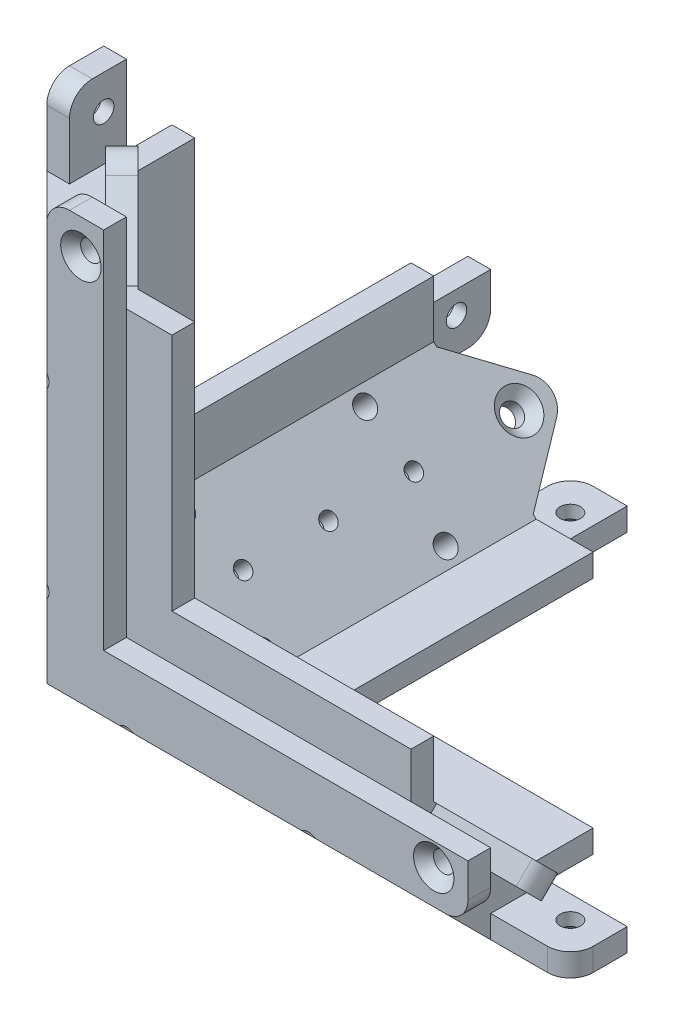
from build123d import *

# Parameters (mm, degrees)
BOSS_EXTRUDE1_DEPTH = 78
BOSS_EXTRUDE2_DEPTH = 70
BOSS_EXTRUDE3_DEPTH = 70
CHAMFER1_SIZE       = 18
CHAMFER2_SIZE       = 18
SKETCH4_W           = 100.995280533
SKETCH4_H           = 50
CUT_EXTRUDE1_DEPTH  = 4
SKETCH5_W           = 50
SKETCH5_H           = 50
CUT_EXTRUDE2_DEPTH  = 4
SKETCH6_W           = 50
SKETCH6_H           = 50
CUT_EXTRUDE3_DEPTH  = 4
SKETCH7_R           = 1.4
CUT_EXTRUDE7_DEPTH  = 3.5
SKETCH8_R           = 1.4
CUT_EXTRUDE8_DEPTH  = 3.5
SKETCH10_R          = 1.4
CUT_EXTRUDE9_DEPTH  = 3.5
SKETCH11_W          = 10
SKETCH11_H          = 4
SKETCH11_W_2        = 4
SKETCH11_H_2        = 10
BOSS_EXTRUDE4_DEPTH = 14
FILLET1_R           = 4
BOSS_EXTRUDE5_DEPTH = 4
FILLET2_R           = 4
SKETCH13_W          = 10
SKETCH13_H          = 4
SKETCH13_W_2        = 4
SKETCH13_H_2        = 10
BOSS_EXTRUDE6_DEPTH = 14
FILLET3_R           = 4
BOSS_EXTRUDE7_DEPTH = 4
FILLET4_R           = 4
BOSS_EXTRUDE8_DEPTH = 4
FILLET5_R           = 4
SKETCH16_W          = 4
SKETCH16_H          = 10
SKETCH16_W_2        = 10
SKETCH16_H_2        = 4
BOSS_EXTRUDE9_DEPTH = 14
FILLET6_R           = 4
SKETCH17_R          = 1.8
CUT_EXTRUDE10_DEPTH = 14
SKETCH18_R          = 1.8
CUT_EXTRUDE11_DEPTH = 14
SKETCH19_R          = 1.8
CUT_EXTRUDE12_DEPTH = 14
SKETCH20_R          = 1.8
CUT_EXTRUDE13_DEPTH = 14
SKETCH21_R          = 1.8
CUT_EXTRUDE14_DEPTH = 14
SKETCH22_R          = 1.8
CUT_EXTRUDE15_DEPTH = 14
CHAMFER3_SIZE       = 1.75
SKETCH27_R          = 1.8
CUT_EXTRUDE19_DEPTH = 141.406552554
SKETCH29_R          = 3
CUT_EXTRUDE20_DEPTH = 4
SKETCH31_R          = 1.8
CUT_EXTRUDE21_DEPTH = 150.13752043
SKETCH32_R          = 3
CUT_EXTRUDE22_DEPTH = 4
SKETCH33_R          = 1.8
CUT_EXTRUDE23_DEPTH = 150.13752043
SKETCH34_R          = 3
CUT_EXTRUDE24_DEPTH = 4


with BuildPart() as part:
    # Sketch1 → Boss-Extrude1 (new body)
    with BuildSketch(Plane(origin=(0, 0, 0), x_dir=(0, 0, -1), z_dir=(1, 0, 0))):
        Polygon((0, 36), (0, 0), (36, 0), (36, 8), (8, 8), (8, 36), align=None)
    extrude(amount=BOSS_EXTRUDE1_DEPTH)

    # Sketch2 → Boss-Extrude2 (add)
    with BuildSketch(Plane(origin=(0, 0, -8), x_dir=(-1, 0, 0), z_dir=(0, 0, -1))):
        Polygon((0, 36), (-8, 36), (-8, 8), (-36, 8), (-36, 0), (0, 0), align=None)
    extrude(amount=BOSS_EXTRUDE2_DEPTH)

    # Sketch3 → Boss-Extrude3 (add)
    with BuildSketch(Plane(origin=(0, 8, 0), x_dir=(1, 0, 0), z_dir=(0, 1, 0))):
        Polygon((0, 0), (0, 36), (8, 36), (8, 8), (36, 8), (36, 0), align=None)
    extrude(amount=BOSS_EXTRUDE3_DEPTH)

    # Chamfer1
    chamfer1_edges = [part.edges().sort_by_distance(p)[0] for p in [
        (43, 8, -8),
        (8, 8, -43),
        (8, 43, -8),
    ]]
    chamfer(chamfer1_edges, length=CHAMFER1_SIZE)

    # Chamfer2
    chamfer2_edges = [part.edges().sort_by_distance(p)[0] for p in [
        (39, 0, 0),
        (0, 0, -39),
        (0, 39, 0),
    ]]
    chamfer(chamfer2_edges, length=CHAMFER2_SIZE)

    # Sketch4 → Cut-Extrude1 (cut)
    with BuildSketch(Plane(origin=(0, 0, 0), x_dir=(-1, 0, 0), z_dir=(0, -1, 0))):
        with Locations((-78.497640266, 53)):
            Rectangle(SKETCH4_W, SKETCH4_H)
    extrude(amount=-CUT_EXTRUDE1_DEPTH, mode=Mode.SUBTRACT)

    # Sketch5 → Cut-Extrude2 (cut)
    with BuildSketch(Plane.XY):
        with Locations((53, 53)):
            Rectangle(SKETCH5_W, SKETCH5_H)
    extrude(amount=-CUT_EXTRUDE2_DEPTH, mode=Mode.SUBTRACT)

    # Sketch6 → Cut-Extrude3 (cut)
    with BuildSketch(Plane.ZY):
        with Locations((-53, 53)):
            Rectangle(SKETCH6_W, SKETCH6_H)
    extrude(amount=-CUT_EXTRUDE3_DEPTH, mode=Mode.SUBTRACT)

    # Sketch7 → Cut-Extrude7 (cut)
    with BuildSketch(Plane(origin=(17, 17, 0), x_dir=(0, 0, -1), z_dir=(0.7071067811865513, 0.7071067811865438, 0))):
        with Locations(Location((65.5, 0, 0), (0, 0, 90))):
            Circle(SKETCH7_R)
        with Locations(Location((50.5, 0, 0), (0, 0, 90))):
            Circle(SKETCH7_R)
        with Locations(Location((35.5, 0, 0), (0, 0, 90))):
            Circle(SKETCH7_R)
    extrude(amount=-CUT_EXTRUDE7_DEPTH, mode=Mode.SUBTRACT)

    # Sketch8 → Cut-Extrude8 (cut)
    with BuildSketch(Plane(origin=(17, 0, -17), x_dir=(-0.7071067811865438, 0, -0.7071067811865513), z_dir=(0.7071067811865513, 0, -0.7071067811865438))):
        with Locations((0, 65.5)):
            Circle(SKETCH8_R)
        with Locations((0, 50.5)):
            Circle(SKETCH8_R)
        with Locations((0, 35.5)):
            Circle(SKETCH8_R)
    extrude(amount=-CUT_EXTRUDE8_DEPTH, mode=Mode.SUBTRACT)

    # Sketch10 → Cut-Extrude9 (cut)
    with BuildSketch(Plane(origin=(0, 17, -17), x_dir=(1, 0, 0), z_dir=(0, 0.7071067811865513, -0.7071067811865438))):
        with Locations(Location((65.5, 0, 0), (0, 0, 270))):
            Circle(SKETCH10_R)
        with Locations(Location((50.5, 0, 0), (0, 0, 270))):
            Circle(SKETCH10_R)
        with Locations(Location((35.5, 0, 0), (0, 0, 270))):
            Circle(SKETCH10_R)
    extrude(amount=-CUT_EXTRUDE9_DEPTH, mode=Mode.SUBTRACT)

    # Sketch11 → Boss-Extrude4 (add)
    with BuildSketch(Plane(origin=(78, 0, 0), x_dir=(0, 0, -1), z_dir=(1, 0, 0))):
        with Locations((23, 2)):
            Rectangle(SKETCH11_W, SKETCH11_H)
        with Locations((2, 23)):
            Rectangle(SKETCH11_W_2, SKETCH11_H_2)
    extrude(amount=BOSS_EXTRUDE4_DEPTH)

    # Fillet1
    fillet1_edges = [part.edges().sort_by_distance(p)[0] for p in [
        (92, 18, -2),
        (92, 2, -18),
    ]]
    fillet(fillet1_edges, radius=FILLET1_R)

    # Sketch12 → Boss-Extrude5 (add)
    with BuildSketch(Plane(origin=(0, 17, -17), x_dir=(1, 0, 0), z_dir=(0, 0.7071067811865513, -0.7071067811865438))):
        Polygon((78, 12), (92, 0), (78, -12), align=None)
    extrude(amount=-BOSS_EXTRUDE5_DEPTH)

    # Fillet2
    fillet2_edges = [part.edges().sort_by_distance(p)[0] for p in [
        (92, 15.585786438, -15.585786438),
    ]]
    fillet(fillet2_edges, radius=FILLET2_R)

    # Sketch13 → Boss-Extrude6 (add)
    with BuildSketch(Plane(origin=(0, 0, -78), x_dir=(-1, 0, 0), z_dir=(0, 0, -1))):
        with Locations((-23, 2)):
            Rectangle(SKETCH13_W, SKETCH13_H)
        with Locations((-2, 23)):
            Rectangle(SKETCH13_W_2, SKETCH13_H_2)
    extrude(amount=BOSS_EXTRUDE6_DEPTH)

    # Fillet3
    fillet3_edges = [part.edges().sort_by_distance(p)[0] for p in [
        (18, 2, -92),
        (2, 18, -92),
    ]]
    fillet(fillet3_edges, radius=FILLET3_R)

    # Sketch14 → Boss-Extrude7 (add)
    with BuildSketch(Plane(origin=(17, 17, 0), x_dir=(0, 0, -1), z_dir=(0.7071067811865511, 0.707106781186544, 0))):
        Polygon((78, 12), (92, 0), (78, -12), align=None)
    extrude(amount=-BOSS_EXTRUDE7_DEPTH)

    # Fillet4
    fillet4_edges = [part.edges().sort_by_distance(p)[0] for p in [
        (15.585786438, 15.585786438, -92),
    ]]
    fillet(fillet4_edges, radius=FILLET4_R)

    # Sketch15 → Boss-Extrude8 (add)
    with BuildSketch(Plane(origin=(17, 0, -17), x_dir=(-0.7071067811865438, 0, -0.7071067811865513), z_dir=(0.7071067811865513, 0, -0.7071067811865438))):
        Polygon((-12, 78), (0, 92), (12, 78), align=None)
    extrude(amount=-BOSS_EXTRUDE8_DEPTH)

    # Fillet5
    fillet5_edges = [part.edges().sort_by_distance(p)[0] for p in [
        (15.585786438, 92, -15.585786438),
    ]]
    fillet(fillet5_edges, radius=FILLET5_R)

    # Sketch16 → Boss-Extrude9 (add)
    with BuildSketch(Plane(origin=(0, 78, 0), x_dir=(1, 0, 0), z_dir=(0, 1, 0))):
        with Locations((2, 23)):
            Rectangle(SKETCH16_W, SKETCH16_H)
        with Locations((23, 2)):
            Rectangle(SKETCH16_W_2, SKETCH16_H_2)
    extrude(amount=BOSS_EXTRUDE9_DEPTH)

    # Fillet6
    fillet6_edges = [part.edges().sort_by_distance(p)[0] for p in [
        (2, 92, -18),
        (18, 92, -2),
    ]]
    fillet(fillet6_edges, radius=FILLET6_R)

    # Sketch17 → Cut-Extrude10 (cut)
    with BuildSketch(Plane(origin=(17, 17, 0), x_dir=(0, 0, -1), z_dir=(0.7071067811865511, 0.707106781186544, 0))):
        with Locations(Location((84, 0, 0), (0, 0, 90))):
            Circle(SKETCH17_R)
    extrude(amount=-CUT_EXTRUDE10_DEPTH, mode=Mode.SUBTRACT)

    # Sketch18 → Cut-Extrude11 (cut)
    with BuildSketch(Plane(origin=(17, 0, -17), x_dir=(-0.7071067811865438, 0, -0.7071067811865513), z_dir=(0.7071067811865513, 0, -0.7071067811865438))):
        with Locations((0, 84)):
            Circle(SKETCH18_R)
    extrude(amount=-CUT_EXTRUDE11_DEPTH, mode=Mode.SUBTRACT)

    # Sketch19 → Cut-Extrude12 (cut)
    with BuildSketch(Plane(origin=(0, 17, -17), x_dir=(1, 0, 0), z_dir=(0, 0.7071067811865513, -0.7071067811865438))):
        with Locations(Location((84, 0, 0), (0, 0, 270))):
            Circle(SKETCH19_R)
    extrude(amount=-CUT_EXTRUDE12_DEPTH, mode=Mode.SUBTRACT)

    # Sketch20 → Cut-Extrude13 (cut)
    with BuildSketch(Plane(origin=(0, 0, 0), x_dir=(-1, 0, 0), z_dir=(0, -1, 0))):
        with Locations(Location((-86, 24, 0), (0, 0, 90))):
            Circle(SKETCH20_R)
        with Locations(Location((-24, 86, 0), (0, 0, 90))):
            Circle(SKETCH20_R)
    extrude(amount=-CUT_EXTRUDE13_DEPTH, mode=Mode.SUBTRACT)

    # Sketch21 → Cut-Extrude14 (cut)
    with BuildSketch(Plane.ZY):
        with Locations((-24, 86)):
            Circle(SKETCH21_R)
        with Locations((-86, 24)):
            Circle(SKETCH21_R)
    extrude(amount=-CUT_EXTRUDE14_DEPTH, mode=Mode.SUBTRACT)

    # Sketch22 → Cut-Extrude15 (cut)
    with BuildSketch(Plane.XY):
        with Locations((24, 86)):
            Circle(SKETCH22_R)
        with Locations((86, 24)):
            Circle(SKETCH22_R)
    extrude(amount=-CUT_EXTRUDE15_DEPTH, mode=Mode.SUBTRACT)

    # Chamfer3
    chamfer3_edges = [part.edges().sort_by_distance(p)[0] for p in [
        (18.272792206, 15.727207794, -84),
        (18.272792206, 84, -15.727207794),
        (84, 15.727207794, -18.272792206),
        (86, 0, -22.2),
        (24, 0, -84.2),
        (0, 86, -25.8),
        (0, 24, -87.8),
        (22.2, 86, 0),
        (84.2, 24, 0),
    ]]
    chamfer(chamfer3_edges, length=CHAMFER3_SIZE)

    # Sketch27 → Cut-Extrude19 (cut, through all)
    with BuildSketch(Plane(origin=(17, 17, 0), x_dir=(0, 0, -1), z_dir=(0.7071067811865511, 0.707106781186544, 0))):
        with Locations(Location((32.022569503, -10, 0), (0, 0, 90))):
            Circle(SKETCH27_R)
        with Locations(Location((32.022569503, 10, 0), (0, 0, 90))):
            Circle(SKETCH27_R)
        with Locations(Location((64.022569503, 10, 0), (0, 0, 90))):
            Circle(SKETCH27_R)
        with Locations(Location((64.022569503, -10, 0), (0, 0, 90))):
            Circle(SKETCH27_R)
    extrude(amount=-CUT_EXTRUDE19_DEPTH, mode=Mode.SUBTRACT)

    # Sketch29 → Cut-Extrude20 (cut)
    with BuildSketch(Plane(origin=(9, 9, 0), x_dir=(0, 0, 1), z_dir=(-0.7071067811865487, -0.7071067811865465, 0))):
        with Locations(Location((-64.022569503, 10, 0), (0, 0, 270))):
            Circle(SKETCH29_R)
        with Locations(Location((-32.022569503, 10, 0), (0, 0, 270))):
            Circle(SKETCH29_R)
        with Locations(Location((-32.022569503, -10, 0), (0, 0, 270))):
            Circle(SKETCH29_R)
        with Locations(Location((-64.022569503, -10, 0), (0, 0, 270))):
            Circle(SKETCH29_R)
    extrude(amount=-CUT_EXTRUDE20_DEPTH, mode=Mode.SUBTRACT)

    # Sketch31 → Cut-Extrude21 (cut, through all)
    with BuildSketch(Plane(origin=(9, 0, -9), x_dir=(0.7071067811865465, 0, 0.7071067811865487), z_dir=(-0.7071067811865487, 0, 0.7071067811865465))):
        with Locations((-10, 64)):
            Circle(SKETCH31_R)
        with Locations((10, 64)):
            Circle(SKETCH31_R)
        with Locations((10, 32)):
            Circle(SKETCH31_R)
        with Locations((-10, 32)):
            Circle(SKETCH31_R)
    extrude(amount=-CUT_EXTRUDE21_DEPTH, mode=Mode.SUBTRACT)

    # Sketch32 → Cut-Extrude22 (cut)
    with BuildSketch(Plane(origin=(9, 0, -9), x_dir=(0.7071067811865465, 0, 0.7071067811865487), z_dir=(-0.7071067811865487, 0, 0.7071067811865465))):
        with Locations((-10, 64)):
            Circle(SKETCH32_R)
        with Locations((10, 64)):
            Circle(SKETCH32_R)
        with Locations((10, 32)):
            Circle(SKETCH32_R)
        with Locations((-10, 32)):
            Circle(SKETCH32_R)
    extrude(amount=-CUT_EXTRUDE22_DEPTH, mode=Mode.SUBTRACT)

    # Sketch33 → Cut-Extrude23 (cut, through all)
    with BuildSketch(Plane(origin=(0, 9, -9), x_dir=(1, 0, 0), z_dir=(0, -0.7071067811865465, 0.7071067811865487))):
        with Locations(Location((64, 10, 0), (0, 0, 270))):
            Circle(SKETCH33_R)
        with Locations(Location((64, -10, 0), (0, 0, 270))):
            Circle(SKETCH33_R)
        with Locations(Location((32, 10, 0), (0, 0, 270))):
            Circle(SKETCH33_R)
        with Locations(Location((32, -10, 0), (0, 0, 270))):
            Circle(SKETCH33_R)
    extrude(amount=-CUT_EXTRUDE23_DEPTH, mode=Mode.SUBTRACT)

    # Sketch34 → Cut-Extrude24 (cut)
    with BuildSketch(Plane(origin=(0, 9, -9), x_dir=(1, 0, 0), z_dir=(0, -0.7071067811865465, 0.7071067811865487))):
        with Locations(Location((32, 10, 0), (0, 0, 270))):
            Circle(SKETCH34_R)
        with Locations(Location((64, 10, 0), (0, 0, 270))):
            Circle(SKETCH34_R)
        with Locations(Location((64, -10, 0), (0, 0, 270))):
            Circle(SKETCH34_R)
        with Locations(Location((32, -10, 0), (0, 0, 270))):
            Circle(SKETCH34_R)
    extrude(amount=-CUT_EXTRUDE24_DEPTH, mode=Mode.SUBTRACT)


solid = part.part
